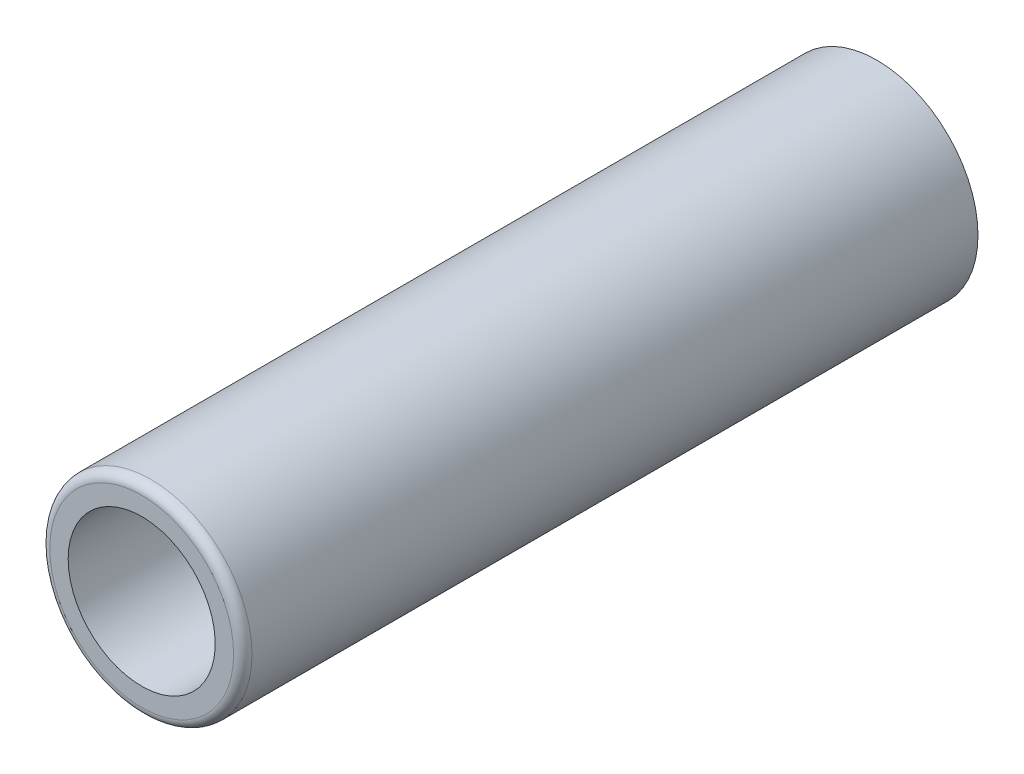
from build123d import *

# Parameters (mm, degrees)
SCHIZZO1_R                   = 55
ESTRUSIONE_ESTRUSIONE1_DEPTH = 400
SCHIZZO2_R                   = 40
TAGLIO_ESTRUSIONE1_DEPTH     = 408.492331216
RACCORDO1_R                  = 5


with BuildPart() as part:
    # Schizzo1 → Estrusione-Estrusione1 (new body)
    with BuildSketch(Plane.XY):
        Circle(SCHIZZO1_R)
    extrude(amount=ESTRUSIONE_ESTRUSIONE1_DEPTH)

    # Schizzo2 → Taglio-Estrusione1 (cut, through all)
    with BuildSketch(Plane(origin=(0, 0, 0), x_dir=(-1, 0, 0), z_dir=(0, 0, -1))):
        Circle(SCHIZZO2_R)
    extrude(amount=-TAGLIO_ESTRUSIONE1_DEPTH, mode=Mode.SUBTRACT)

    # Raccordo1
    raccordo1_edges = [part.edges().sort_by_distance(p)[0] for p in [
        (-55, 0, 400),
    ]]
    fillet(raccordo1_edges, radius=RACCORDO1_R)


solid = part.part
